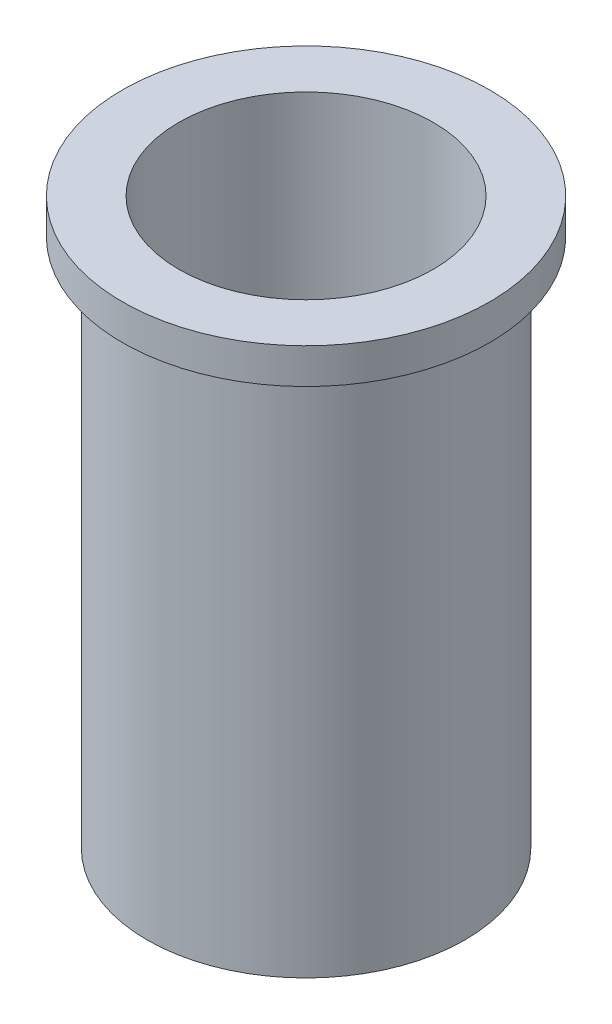
from build123d import *


with BuildPart() as part:
    # Sketch1 → Revolve1 (revolve)
    with BuildSketch(Plane.XY, mode=Mode.PRIVATE) as revolve1_sk:
        Polygon((11.44578836, 50.8), (11.44578836, 0), (14.2875, 0), (14.2875, 47.625), (16.51, 47.625), (16.51, 50.8), align=None)
    revolve(revolve1_sk.sketch.rotate(Axis((0, 0, 0), (0, 1, 0)), 90), axis=Axis((0, 0, 0), (0, 1, 0)))


solid = part.part
